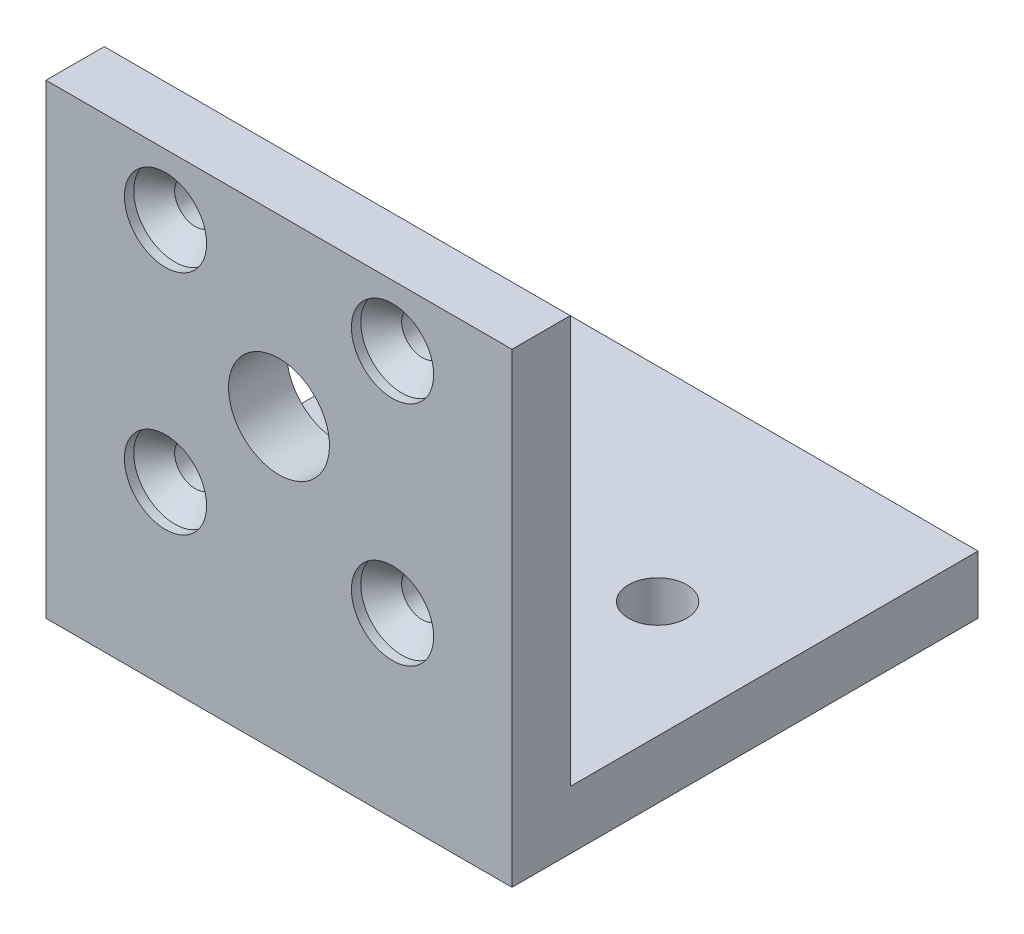
from build123d import *

# Parameters (mm, degrees)
BOSS_EXTRUDE1_DEPTH          = 50.8
CUT_EXTRUDE1_REACH           = 86.481
SKETCH2_R                    = 2.25
SKETCH2_R_2                  = 5.5
CUT_EXTRUDE2_REACH           = 82.822
SKETCH4_R                    = 3.175
CSK_FOR_M4_SFHCS1_AT_2_COUNT = 2
CSK_FOR_M4_SFHCS1_AT_2_PITCH = 24.748737342
CSK_FOR_M4_SFHCS1_AT_3_COUNT = 2
CSK_FOR_M4_SFHCS1_AT_3_PITCH = 35
CSK_FOR_M4_SFHCS1_AT_4_COUNT = 2
CSK_FOR_M4_SFHCS1_AT_4_PITCH = 24.748737342


with BuildPart() as part:
    # Sketch1 → Boss-Extrude1 (new body)
    with BuildSketch(Plane(origin=(0, 0, 0), x_dir=(0, 0, -1), z_dir=(1, 0, 0))):
        Polygon((0, 0), (0, -44.45), (44.45, -44.45), (44.45, -50.8), (-6.35, -50.8), (-6.35, 0), align=None)
    extrude(amount=BOSS_EXTRUDE1_DEPTH)

    # Sketch2 → Cut-Extrude1 (cut, up to next)
    with BuildSketch(Plane(origin=(0, 0, 0), x_dir=(-1, 0, 0), z_dir=(0, 0, -1)), mode=Mode.PRIVATE) as cut_extrude1_sk1:
        with Locations(Location((-13.025631329, -6.675631329, 0), (0, 0, 90))):
            Circle(SKETCH2_R)
    cut_extrude1_tool1 = extrude(cut_extrude1_sk1.sketch, amount=-CUT_EXTRUDE1_REACH, mode=Mode.PRIVATE) & part.part
    # Sketch2 → Cut-Extrude1 (cut, up to next)
    with BuildSketch(Plane(origin=(0, 0, 0), x_dir=(-1, 0, 0), z_dir=(0, 0, -1)), mode=Mode.PRIVATE) as cut_extrude1_sk2:
        with Locations(Location((-13.025631329, -31.424368671, 0), (0, 0, 90))):
            Circle(SKETCH2_R)
    cut_extrude1_tool2 = extrude(cut_extrude1_sk2.sketch, amount=-CUT_EXTRUDE1_REACH, mode=Mode.PRIVATE) & part.part
    # Sketch2 → Cut-Extrude1 (cut, up to next)
    with BuildSketch(Plane(origin=(0, 0, 0), x_dir=(-1, 0, 0), z_dir=(0, 0, -1)), mode=Mode.PRIVATE) as cut_extrude1_sk3:
        with Locations(Location((-37.774368671, -31.424368671, 0), (0, 0, 90))):
            Circle(SKETCH2_R)
    cut_extrude1_tool3 = extrude(cut_extrude1_sk3.sketch, amount=-CUT_EXTRUDE1_REACH, mode=Mode.PRIVATE) & part.part
    # Sketch2 → Cut-Extrude1 (cut, up to next)
    with BuildSketch(Plane(origin=(0, 0, 0), x_dir=(-1, 0, 0), z_dir=(0, 0, -1)), mode=Mode.PRIVATE) as cut_extrude1_sk4:
        with Locations(Location((-37.774368671, -6.675631329, 0), (0, 0, 90))):
            Circle(SKETCH2_R)
    cut_extrude1_tool4 = extrude(cut_extrude1_sk4.sketch, amount=-CUT_EXTRUDE1_REACH, mode=Mode.PRIVATE) & part.part
    # Sketch2 → Cut-Extrude1 (cut, up to next)
    with BuildSketch(Plane(origin=(0, 0, 0), x_dir=(-1, 0, 0), z_dir=(0, 0, -1)), mode=Mode.PRIVATE) as cut_extrude1_sk5:
        with Locations(Location((-25.4, -19.05, 0), (0, 0, 90))):
            Circle(SKETCH2_R_2)
    cut_extrude1_tool5 = extrude(cut_extrude1_sk5.sketch, amount=-CUT_EXTRUDE1_REACH, mode=Mode.PRIVATE) & part.part
    add(cut_extrude1_tool1.solids().sort_by_distance((13.025631, -6.675631, 0))[0], mode=Mode.SUBTRACT)
    add(cut_extrude1_tool2.solids().sort_by_distance((13.025631, -31.424369, 0))[0], mode=Mode.SUBTRACT)
    add(cut_extrude1_tool3.solids().sort_by_distance((37.774369, -31.424369, 0))[0], mode=Mode.SUBTRACT)
    add(cut_extrude1_tool4.solids().sort_by_distance((37.774369, -6.675631, 0))[0], mode=Mode.SUBTRACT)
    add(cut_extrude1_tool5.solids().sort_by_distance((25.4, -19.05, 0))[0], mode=Mode.SUBTRACT)

    # Sketch4 → Cut-Extrude2 (cut, up to next)
    with BuildSketch(Plane(origin=(0, -44.45, 0), x_dir=(1, 0, 0), z_dir=(0, 1, 0)), mode=Mode.PRIVATE) as cut_extrude2_sk1:
        with Locations(Location((12.7, 22.225, 0), (0, 0, 270))):
            Circle(SKETCH4_R)
    cut_extrude2_tool1 = extrude(cut_extrude2_sk1.sketch, amount=-CUT_EXTRUDE2_REACH, mode=Mode.PRIVATE) & part.part
    # Sketch4 → Cut-Extrude2 (cut, up to next)
    with BuildSketch(Plane(origin=(0, -44.45, 0), x_dir=(1, 0, 0), z_dir=(0, 1, 0)), mode=Mode.PRIVATE) as cut_extrude2_sk2:
        with Locations(Location((38.1, 22.225, 0), (0, 0, 270))):
            Circle(SKETCH4_R)
    cut_extrude2_tool2 = extrude(cut_extrude2_sk2.sketch, amount=-CUT_EXTRUDE2_REACH, mode=Mode.PRIVATE) & part.part
    add(cut_extrude2_tool1.solids().sort_by_distance((12.7, -44.45, -22.225))[0], mode=Mode.SUBTRACT)
    add(cut_extrude2_tool2.solids().sort_by_distance((38.1, -44.45, -22.225))[0], mode=Mode.SUBTRACT)

    # Sketch5 → CSK for M4 SFHCS1 (revolve, cut)
    with BuildSketch(Plane(origin=(13.025631329, -6.675631329, 6.35), x_dir=(0, -1, 0), z_dir=(1, 0, 0))):
        Polygon((0, 0), (0, 50.8), (2.15, 50.8), (2.15, 3.346), (4.48, 1.016), (4.48, 0), align=None)
    csk_for_m4_sfhcs1 = revolve(axis=Axis((13.025631329, -6.675631329, 12.7), (0, 0, -1)), mode=Mode.SUBTRACT)

    # CSK for M4 SFHCS1 at 2: CSK for M4 SFHCS1 ×2
    with Locations(*[(i * CSK_FOR_M4_SFHCS1_AT_2_PITCH, 0, 0) for i in range(1, CSK_FOR_M4_SFHCS1_AT_2_COUNT)]):
        add(csk_for_m4_sfhcs1, mode=Mode.SUBTRACT)

    # CSK for M4 SFHCS1 at 3: CSK for M4 SFHCS1 ×2
    with Locations(*[Vector(0.7071067811865426, -0.7071067811865525, 0) * (i * CSK_FOR_M4_SFHCS1_AT_3_PITCH) for i in range(1, CSK_FOR_M4_SFHCS1_AT_3_COUNT)]):
        add(csk_for_m4_sfhcs1, mode=Mode.SUBTRACT)

    # CSK for M4 SFHCS1 at 4: CSK for M4 SFHCS1 ×2
    with Locations(*[(0, -i * CSK_FOR_M4_SFHCS1_AT_4_PITCH, 0) for i in range(1, CSK_FOR_M4_SFHCS1_AT_4_COUNT)]):
        add(csk_for_m4_sfhcs1, mode=Mode.SUBTRACT)


solid = part.part
